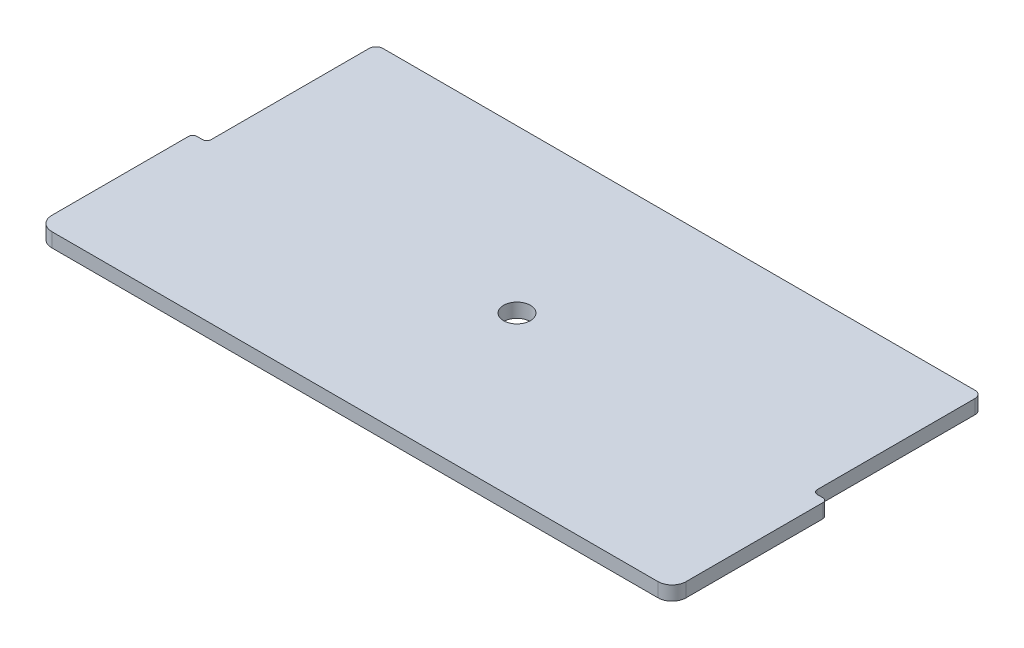
from build123d import *

# Parameters (mm, degrees)
SKETCH2_W           = 450
SKETCH2_H           = 230
BOSS_EXTRUDE2_DEPTH = 10
SKETCH4_W           = 10
SKETCH4_H           = 120
CUT_EXTRUDE2_DEPTH  = 286
FILLET1_R           = 10
FILLET7_R           = 3
FILLET8_R           = 5
FILLET9_R           = 3
FILLET10_R          = 10
SKETCH5_R           = 9.5
CUT_EXTRUDE4_DEPTH  = 10


with BuildPart() as part:
    # Sketch2 → Boss-Extrude2 (new body)
    with BuildSketch(Plane(origin=(0, 0, 0), x_dir=(1, 0, 0), z_dir=(0, 1, 0))):
        with Locations((176.829853391, -84.071504635)):
            Rectangle(SKETCH2_W, SKETCH2_H)
    extrude(amount=BOSS_EXTRUDE2_DEPTH)

    # Sketch4 → Cut-Extrude2 (cut)
    with BuildSketch(Plane(origin=(0, 10, 0), x_dir=(1, 0, 0), z_dir=(0, 1, 0))):
        with Locations((-43.170146609, -29.071504635)):
            Rectangle(SKETCH4_W, SKETCH4_H)
        with Locations((396.829853391, -29.071504635)):
            Rectangle(SKETCH4_W, SKETCH4_H)
    extrude(amount=-CUT_EXTRUDE2_DEPTH, mode=Mode.SUBTRACT)

    # Fillet1
    fillet1_edges = [part.edges().sort_by_distance(p)[0] for p in [
        (-48.170146609, 5, 199.071504635),
    ]]
    fillet(fillet1_edges, radius=FILLET1_R)

    # Fillet7
    fillet7_edges = [part.edges().sort_by_distance(p)[0] for p in [
        (-48.170146609, 5, 89.071504635),
        (-38.170146609, 5, 89.071504635),
    ]]
    fillet(fillet7_edges, radius=FILLET7_R)

    # Fillet8
    fillet8_edges = [part.edges().sort_by_distance(p)[0] for p in [
        (-38.170146609, 5, -30.928495365),
        (391.829853391, 5, -30.928495365),
    ]]
    fillet(fillet8_edges, radius=FILLET8_R)

    # Fillet9
    fillet9_edges = [part.edges().sort_by_distance(p)[0] for p in [
        (401.829853391, 5, 89.071504635),
        (391.829853391, 5, 89.071504635),
    ]]
    fillet(fillet9_edges, radius=FILLET9_R)

    # Fillet10
    fillet10_edges = [part.edges().sort_by_distance(p)[0] for p in [
        (401.829853391, 5, 199.071504635),
    ]]
    fillet(fillet10_edges, radius=FILLET10_R)

    # Sketch5 → Cut-Extrude4 (cut)
    with BuildSketch(Plane(origin=(0, 10, 0), x_dir=(1, 0, 0), z_dir=(0, 1, 0))):
        with Locations(Location((176.829853391, -84.071504635, 0), (0, 0, 270))):
            Circle(SKETCH5_R)
    extrude(amount=-CUT_EXTRUDE4_DEPTH, mode=Mode.SUBTRACT)


solid = part.part
